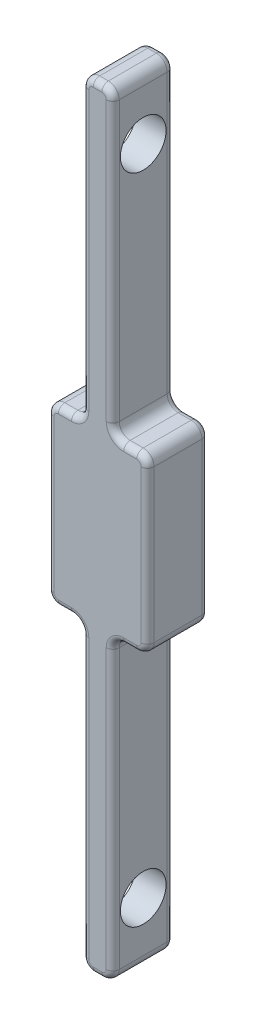
from build123d import *

# Parameters (mm, degrees)
BOSS_EXTRUDE1_DEPTH = 14
SKETCH5_R           = 5.25
CUT_EXTRUDE1_DEPTH  = 92.33454987
CUT_EXTRUDE3_DEPTH  = 1.4
SKETCH9_R           = 0.575
SKETCH9_R_2         = 0.5
CUT_EXTRUDE5_DEPTH  = 8
FILLET1_R           = 2.5
FILLET2_R           = 1.5
FILLET3_R           = 1.5


with BuildPart() as part:
    # Sketch4 → Boss-Extrude1 (new body)
    with BuildSketch(Plane(origin=(0, 0, 0), x_dir=(0, 1, 0), z_dir=(0, 0, 1))):
        Polygon((-89, -3.5), (-89, 3.5), (-20, 3.5), (-20, 11.5), (20, 11.5), (20, 3.5), (89, 3.5), (89, -3.5), (20, -3.5), (20, -11.5), (-20, -11.5), (-20, -3.5), align=None)
    extrude(amount=BOSS_EXTRUDE1_DEPTH)

    # Sketch5 → Cut-Extrude1 (cut, through all)
    with BuildSketch(Plane.YZ.offset(3.5)):
        with Locations(Location((75, 7, 0), (0, 0, 270))):
            Circle(SKETCH5_R)
        with Locations(Location((-75, 7, 0), (0, 0, 270))):
            Circle(SKETCH5_R)
    extrude(amount=-CUT_EXTRUDE1_DEPTH, mode=Mode.SUBTRACT)

    # Sketch8 → Cut-Extrude3 (cut)
    with BuildSketch(Plane(origin=(0, 0, 0), x_dir=(1, 0, 0), z_dir=(0, 0, -1))):
        with BuildLine():
            Line((2.5, 3.6), (2, 15.6))
            ThreePointArc((2, 15.6), (0, 17.6), (-2, 15.6))
            Line((-2, 15.6), (-2.5, 3.6))
            Line((-2.5, 3.6), (-2.5, 2.590366769))
            ThreePointArc((-2.5, 2.590366769), (-2.762479071, 2.308399745), (-2.993325909, 2))
            Line((-2.993325909, 2), (-6.6, 2))
            ThreePointArc((-6.6, 2), (-8.6, 0), (-6.6, -2))
            Line((-6.6, -2), (-2.993325909, -2))
            ThreePointArc((-2.993325909, -2), (-2.762479071, -2.308399745), (-2.5, -2.590366769))
            Line((-2.5, -2.590366769), (-2.5, -3.6))
            Line((-2.5, -3.6), (-2, -15.6))
            ThreePointArc((-2, -15.6), (0, -17.6), (2, -15.6))
            Line((2, -15.6), (2.5, -3.6))
            Line((2.5, -3.6), (2.5, -2.590366769))
            ThreePointArc((2.5, -2.590366769), (2.762479071, -2.308399745), (2.993325909, -2))
            Line((2.993325909, -2), (6.6, -2))
            ThreePointArc((6.6, -2), (8.6, 0), (6.6, 2))
            Line((6.6, 2), (2.993325909, 2))
            ThreePointArc((2.993325909, 2), (2.762479071, 2.308399745), (2.5, 2.590366769))
            Line((2.5, 2.590366769), (2.5, 3.6))
        make_face()
    extrude(amount=-CUT_EXTRUDE3_DEPTH, mode=Mode.SUBTRACT)

    # Sketch9 → Cut-Extrude5 (cut)
    with BuildSketch(Plane(origin=(0, 0, 1.4), x_dir=(1, 0, 0), z_dir=(0, 0, -1))):
        with Locations(Location((0, 13.4, 0), (0, 0, 180))):
            Circle(SKETCH9_R)
        with Locations(Location((0, 11.2, 0), (0, 0, 180))):
            Circle(SKETCH9_R)
        with Locations(Location((0, 9, 0), (0, 0, 180))):
            Circle(SKETCH9_R)
        with Locations(Location((0, 6.8, 0), (0, 0, 180))):
            Circle(SKETCH9_R)
        with Locations(Location((0, 4.6, 0), (0, 0, 180))):
            Circle(SKETCH9_R)
        with Locations(Location((-6.6, 0, 0), (0, 0, 180))):
            Circle(SKETCH9_R_2)
        with Locations(Location((-4.6, 0, 0), (0, 0, 180))):
            Circle(SKETCH9_R_2)
        with Locations(Location((4.6, 0, 0), (0, 0, 180))):
            Circle(SKETCH9_R_2)
        with Locations(Location((6.6, 0, 0), (0, 0, 180))):
            Circle(SKETCH9_R_2)
        with Locations(Location((0, -4.6, 0), (0, 0, 180))):
            Circle(SKETCH9_R)
        with Locations(Location((0, -6.8, 0), (0, 0, 180))):
            Circle(SKETCH9_R)
        with Locations(Location((0, -9, 0), (0, 0, 180))):
            Circle(SKETCH9_R)
        with Locations(Location((0, -11.2, 0), (0, 0, 180))):
            Circle(SKETCH9_R)
        with Locations(Location((0, -13.4, 0), (0, 0, 180))):
            Circle(SKETCH9_R)
        with Locations(Location((0, -15.6, 0), (0, 0, 180))):
            Circle(SKETCH9_R)
        with Locations(Location((0, 15.6, 0), (0, 0, 180))):
            Circle(SKETCH9_R)
    extrude(amount=-CUT_EXTRUDE5_DEPTH, mode=Mode.SUBTRACT)

    # Fillet1
    fillet1_edges = [part.edges().sort_by_distance(p)[0] for p in [
        (-3.5, -20, 7),
        (-11.5, -20, 7),
        (-11.5, 20, 7),
        (-3.5, 20, 7),
        (-3.5, 89, 7),
        (3.5, 89, 7),
        (3.5, 20, 7),
        (11.5, 20, 7),
        (11.5, -20, 7),
        (3.5, -20, 7),
        (3.5, -89, 7),
        (-3.5, -89, 7),
    ]]
    fillet(fillet1_edges, radius=FILLET1_R)

    # Fillet2
    fillet2_edges = [part.edges().sort_by_distance(p)[0] for p in [
        (-7.5, -20, 14),
        (-11.5, 0, 14),
        (-3.5, -54.5, 14),
        (0, -89, 14),
        (3.5, -54.5, 14),
        (7.5, -20, 14),
        (11.5, 0, 14),
        (7.5, 20, 14),
        (3.5, 54.5, 14),
        (0, 89, 14),
        (-3.5, 54.5, 14),
        (-7.5, 20, 14),
        (2.767766953, 88.267766953, 14),
        (-2.767766953, 88.267766953, 14),
        (2.767766953, -88.267766953, 14),
        (-2.767766953, -88.267766953, 14),
        (10.767766953, 19.267766953, 14),
        (10.767766953, -19.267766953, 14),
        (-10.767766953, 19.267766953, 14),
        (-10.767766953, -19.267766953, 14),
        (-4.232233047, -20.732233047, 14),
        (-4.232233047, 20.732233047, 14),
        (4.232233047, 20.732233047, 14),
        (4.232233047, -20.732233047, 14),
    ]]
    fillet(fillet2_edges, radius=FILLET2_R)

    # Fillet3
    fillet3_edges = [part.edges().sort_by_distance(p)[0] for p in [
        (-7.5, -20, 0),
        (-3.5, -54.5, 0),
        (-11.5, 0, 0),
        (-7.5, 20, 0),
        (-3.5, 54.5, 0),
        (0, 89, 0),
        (3.5, 54.5, 0),
        (7.5, 20, 0),
        (11.5, 0, 0),
        (7.5, -20, 0),
        (3.5, -54.5, 0),
        (0, -89, 0),
        (2.767766953, 88.267766953, 0),
        (-2.767766953, 88.267766953, 0),
        (2.767766953, -88.267766953, 0),
        (-2.767766953, -88.267766953, 0),
        (10.767766953, 19.267766953, 0),
        (10.767766953, -19.267766953, 0),
        (-10.767766953, 19.267766953, 0),
        (-10.767766953, -19.267766953, 0),
        (-4.232233047, -20.732233047, 0),
        (-4.232233047, 20.732233047, 0),
        (4.232233047, 20.732233047, 0),
        (4.232233047, -20.732233047, 0),
    ]]
    fillet(fillet3_edges, radius=FILLET3_R)


solid = part.part
